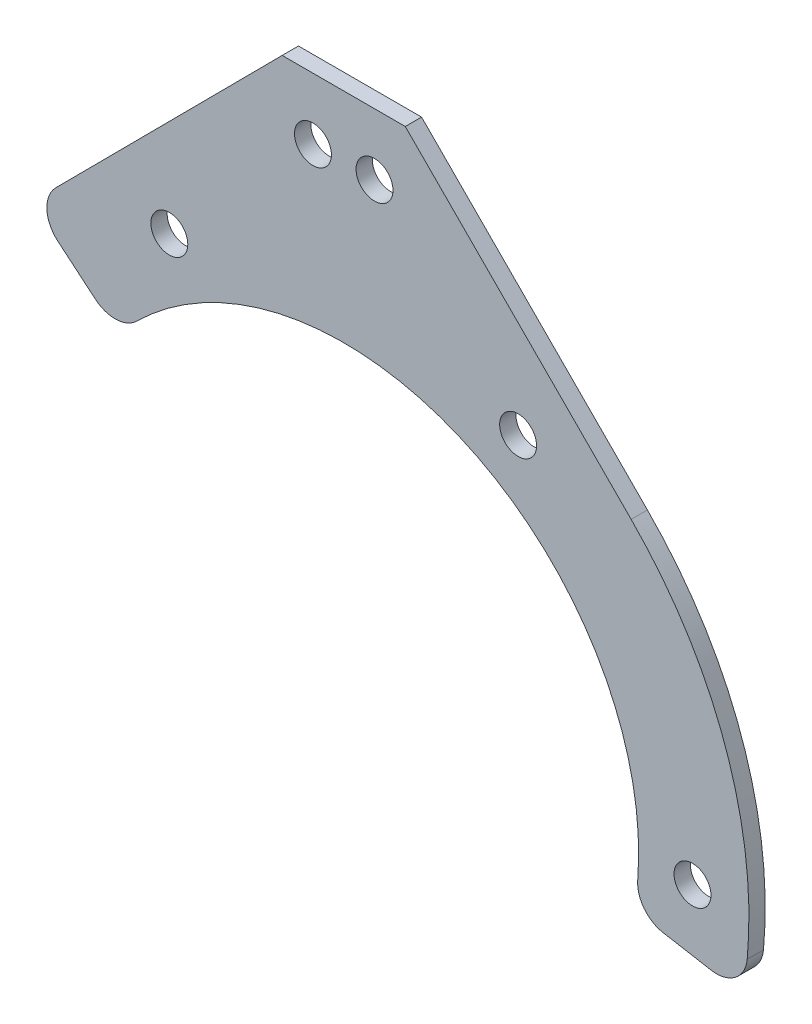
from build123d import *

# Parameters (mm, degrees)
SKETCH1_R                = 39.5
BOSS_EXTRUDE1_DEPTH      = 0.79375
BOSS_EXTRUDE2_DEPTH      = 1.5875
SKETCH2_R                = 28.75
CUT_EXTRUDE1_DEPTH       = 64.739863165
M3_CLEARANCE_HOLE1_D     = 3.6
CIRPATTERN1_COUNT        = 6
M3_CLEARANCE_HOLE2_D     = 3.6
M3_CLEARANCE_HOLE2_DEPTH = 10
M3_CLEARANCE_HOLE2_TIP   = 1.081549114
CUT_EXTRUDE3_DEPTH       = 64.739863165
FILLET1_R                = 3


with BuildPart() as part:
    # Sketch1 → Boss-Extrude1 (new, symmetric)
    with BuildSketch(Plane.XY):
        Circle(SKETCH1_R)
    extrude(amount=BOSS_EXTRUDE1_DEPTH, both=True)

    # Sketch3 → Boss-Extrude2 (add, through all)
    with BuildSketch(Plane.XY.offset(0.79375)):
        Polygon((-28.01836343, 27.842796388), (-6, 50), (6, 50), (28.01836343, 27.842796388), align=None)
    extrude(amount=-BOSS_EXTRUDE2_DEPTH)

    # Sketch2 → Cut-Extrude1 (cut, through all)
    with BuildSketch(Plane.XY.offset(0.79375)):
        Circle(SKETCH2_R)
    extrude(amount=-CUT_EXTRUDE1_DEPTH, mode=Mode.SUBTRACT)

    # M3 Clearance Hole1 (through all)
    with Locations(Plane.XY.offset(0.79375)):
        with Locations((17, -29.444863729)):
            m3_clearance_hole1 = Hole(M3_CLEARANCE_HOLE1_D / 2)

    # CirPattern1: M3 Clearance Hole1 ×6 about axis
    cirpattern1_axis = Axis((0, 0, 0), (0, 0, 1))
    for i in range(1, CIRPATTERN1_COUNT):
        add(m3_clearance_hole1.rotate(cirpattern1_axis, i * 360 / CIRPATTERN1_COUNT), mode=Mode.SUBTRACT)

    # M3 Clearance Hole2
    with Locations(Plane.XY.offset(0.79375)):
        with Locations((3, 44), (-3, 44)):
            Hole(M3_CLEARANCE_HOLE2_D / 2, depth=M3_CLEARANCE_HOLE2_DEPTH)
            with Locations((0, 0, -(M3_CLEARANCE_HOLE2_DEPTH + M3_CLEARANCE_HOLE2_TIP / 2))):  # 118° drill point
                Cone(0, M3_CLEARANCE_HOLE2_D / 2, M3_CLEARANCE_HOLE2_TIP, mode=Mode.SUBTRACT)

    # OpenEdge → Cut-Extrude3 (cut, through all)
    with BuildSketch(Plane(origin=(0, 0, -0.79375), x_dir=(-1, 0, 0), z_dir=(0, 0, -1))):
        with BuildLine():
            Line((22.02377774, 18.480143778), (30.258755503, 25.390110583))
            ThreePointArc((30.258755503, 25.390110583), (16.693421339, -35.799157588), (-38.899906244, -6.859103018))
            Line((-38.899906244, -6.859103018), (-28.313222899, -4.992385108))
            ThreePointArc((-28.313222899, -4.992385108), (12.150275025, -26.056348877), (22.02377774, 18.480143778))
        make_face()
    extrude(amount=-CUT_EXTRUDE3_DEPTH, mode=Mode.SUBTRACT)

    # Fillet1
    fillet1_edges = [part.edges().sort_by_distance(p)[0] for p in [
        (28.313222899, -4.992385108, 0),
        (-22.02377774, 18.480143778, 0),
        (-30.258755503, 25.390110583, 0),
        (38.899906244, -6.859103018, 0),
    ]]
    fillet(fillet1_edges, radius=FILLET1_R)


solid = part.part
